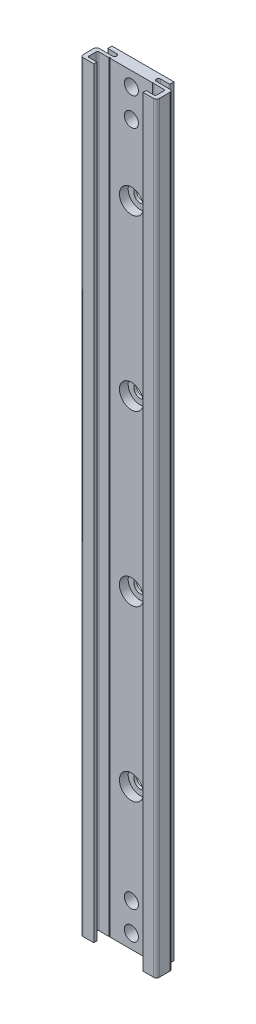
from build123d import *

# Parameters (mm, degrees)
BOSS_EXTRUDE1_DEPTH                              = 270
CUT_EXTRUDE1_DEPTH                               = 271.477244884
F_0_4_0_4_DIAMETER_HOLE1_D                       = 0.4
CBORE_FOR_M4_HEX_HEAD_MACHINE_SCREW1_D           = 4.5
CBORE_FOR_M4_HEX_HEAD_MACHINE_SCREW1_DEPTH       = 4.1
CBORE_FOR_M4_HEX_HEAD_MACHINE_SCREW1_CBORE_D     = 8.5
CBORE_FOR_M4_HEX_HEAD_MACHINE_SCREW1_CBORE_DEPTH = 3.1
FILLET1_R                                        = 0.2
FILLET2_R                                        = 0.5
FILLET3_R                                        = 1
CUT_EXTRUDE2_REACH                               = 302.339
SKETCH7_R                                        = 2.5


with BuildPart() as part:
    # Sketch1 → Boss-Extrude1 (new body)
    with BuildSketch(Plane(origin=(0, 300, 0), x_dir=(1, 0, 0), z_dir=(0, 1, 0))):
        with BuildLine():
            Line((-13.5, -3), (-13.5, -8.7))
            Line((-13.5, -8.7), (13.5, -8.7))
            Line((13.5, -8.7), (13.5, -3))
            Line((13.5, -3), (7.8, -3))
            ThreePointArc((7.8, -3), (7.05, -2.25), (7.8, -1.5))
            Line((7.8, -1.5), (11, -1.5))
            Line((11, -1.5), (11, 0))
            Line((11, 0), (-11, 0))
            Line((-11, 0), (-11, -1.5))
            Line((-11, -1.5), (-7.8, -1.5))
            ThreePointArc((-7.8, -1.5), (-7.05, -2.25), (-7.8, -3))
            Line((-7.8, -3), (-13.5, -3))
        make_face()
    extrude(amount=-BOSS_EXTRUDE1_DEPTH)

    # Sketch2 → Cut-Extrude1 (cut, through all)
    with BuildSketch(Plane.XZ.offset(-30)):
        Polygon((8.75, 8.7), (-8.75, 8.7), (-8.75, 7.6), (-12, 7.6), (-12, 4.1), (12, 4.1), (12, 7.6), (8.75, 7.6), align=None)
    extrude(amount=-CUT_EXTRUDE1_DEPTH, mode=Mode.SUBTRACT)

    # Ø0.4 (0.4) Diameter Hole1 (through all)
    with Locations(Plane(origin=(0, 300, 0), x_dir=(1, 0, 0), z_dir=(0, 1, 0))):
        with Locations((-7.75, -4.1), (7.75, -4.1)):
            Hole(F_0_4_0_4_DIAMETER_HOLE1_D / 2)

    # CBORE for M4 Hex Head Machine Screw1
    with Locations(Plane.XY.offset(4.1)):
        with Locations((0, 260), (0, 200), (0, 140), (0, 80), (0, 20)):
            CounterBoreHole(CBORE_FOR_M4_HEX_HEAD_MACHINE_SCREW1_D / 2, CBORE_FOR_M4_HEX_HEAD_MACHINE_SCREW1_CBORE_D / 2, CBORE_FOR_M4_HEX_HEAD_MACHINE_SCREW1_CBORE_DEPTH, depth=CBORE_FOR_M4_HEX_HEAD_MACHINE_SCREW1_DEPTH)

    # Fillet1
    fillet1_edges = [part.edges().sort_by_distance(p)[0] for p in [
        (-11, 165, 1.5),
        (11, 165, 1.5),
    ]]
    fillet(fillet1_edges, radius=FILLET1_R)

    # Fillet2
    fillet2_edges = [part.edges().sort_by_distance(p)[0] for p in [
        (12, 165, 7.6),
        (12, 165, 4.1),
        (-12, 165, 4.1),
        (-12, 165, 7.6),
    ]]
    fillet(fillet2_edges, radius=FILLET2_R)

    # Fillet3
    fillet3_edges = [part.edges().sort_by_distance(p)[0] for p in [
        (13.5, 165, 3),
        (13.5, 165, 8.7),
        (-13.5, 165, 8.7),
        (-13.5, 165, 3),
    ]]
    fillet(fillet3_edges, radius=FILLET3_R)

    # Sketch7 → Cut-Extrude2 (cut, up to next)
    with BuildSketch(Plane.XY.offset(4.1), mode=Mode.PRIVATE) as cut_extrude2_sk1:
        with Locations((0, 285)):
            Circle(SKETCH7_R)
    cut_extrude2_tool1 = extrude(cut_extrude2_sk1.sketch, amount=-CUT_EXTRUDE2_REACH, mode=Mode.PRIVATE) & part.part
    # Sketch7 → Cut-Extrude2 (cut, up to next)
    with BuildSketch(Plane.XY.offset(4.1), mode=Mode.PRIVATE) as cut_extrude2_sk2:
        with Locations((0, 45)):
            Circle(SKETCH7_R)
    cut_extrude2_tool2 = extrude(cut_extrude2_sk2.sketch, amount=-CUT_EXTRUDE2_REACH, mode=Mode.PRIVATE) & part.part
    # Sketch7 → Cut-Extrude2 (cut, up to next)
    with BuildSketch(Plane.XY.offset(4.1), mode=Mode.PRIVATE) as cut_extrude2_sk3:
        with Locations((0, 35)):
            Circle(SKETCH7_R)
    cut_extrude2_tool3 = extrude(cut_extrude2_sk3.sketch, amount=-CUT_EXTRUDE2_REACH, mode=Mode.PRIVATE) & part.part
    # Sketch7 → Cut-Extrude2 (cut, up to next)
    with BuildSketch(Plane.XY.offset(4.1), mode=Mode.PRIVATE) as cut_extrude2_sk4:
        with Locations((0, 295)):
            Circle(SKETCH7_R)
    cut_extrude2_tool4 = extrude(cut_extrude2_sk4.sketch, amount=-CUT_EXTRUDE2_REACH, mode=Mode.PRIVATE) & part.part
    add(cut_extrude2_tool1.solids().sort_by_distance((0, 285, 4.1))[0], mode=Mode.SUBTRACT)
    add(cut_extrude2_tool2.solids().sort_by_distance((0, 45, 4.1))[0], mode=Mode.SUBTRACT)
    add(cut_extrude2_tool3.solids().sort_by_distance((0, 35, 4.1))[0], mode=Mode.SUBTRACT)
    add(cut_extrude2_tool4.solids().sort_by_distance((0, 295, 4.1))[0], mode=Mode.SUBTRACT)


solid = part.part
